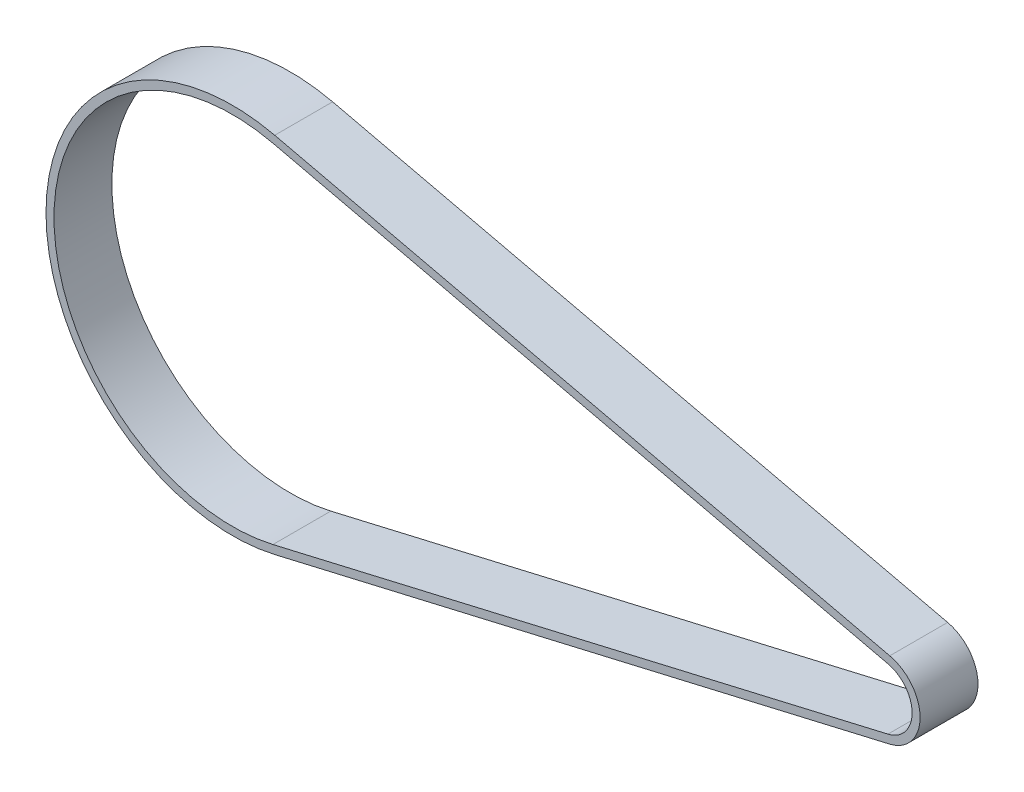
from build123d import *

# Parameters (mm, degrees)
EXTRUDE_1_DEPTH = 10


with BuildPart() as part:
    # Эскиз1 → Бобышка-Вытянуть1 (new body)
    with BuildSketch(Plane.XY):
        with BuildLine():
            Line((7.308152284, 31.36122988), (113.539407595, 6.606008414))
            ThreePointArc((113.539407595, 6.606008414), (118.7830025, 0), (113.539407595, -6.606008414))
            Line((113.539407595, -6.606008414), (7.308152284, -31.36122988))
            ThreePointArc((7.308152284, -31.36122988), (-32.201488, 0), (7.308152284, 31.36122988))
        make_face()
        with BuildLine():
            Line((113.226215542, -5.262017813), (6.994960231, -30.017239279))
            ThreePointArc((6.994960231, -30.017239279), (-30.821488, 0), (6.994960231, 30.017239279))
            Line((6.994960231, 30.017239279), (113.226215542, 5.262017813))
            ThreePointArc((113.226215542, 5.262017813), (117.4030025, 0), (113.226215542, -5.262017813))
        make_face(mode=Mode.SUBTRACT)
    extrude(amount=-EXTRUDE_1_DEPTH)


solid = part.part
